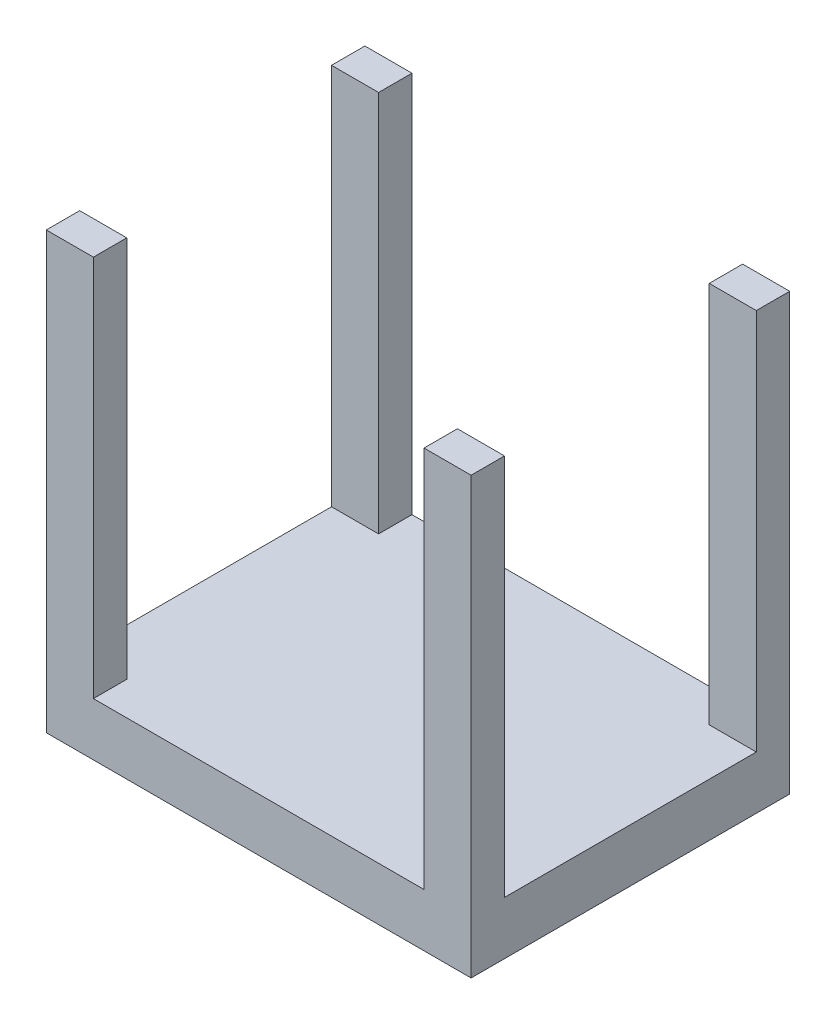
from build123d import *

# Parameters (mm, degrees)
SKETCH1_W           = 2000
SKETCH1_H           = 1500
BOSS_EXTRUDE1_DEPTH = 250
SKETCH2_W           = 221.636306229
SKETCH2_H           = 157.228805466
BOSS_EXTRUDE3_DEPTH = 1800
BOSS_EXTRUDE4_DEPTH = 40


with BuildPart() as part:
    # Sketch1 → Boss-Extrude1 (new body)
    with BuildSketch(Plane(origin=(0, 0, 0), x_dir=(1, 0, 0), z_dir=(0, 1, 0))):
        Rectangle(SKETCH1_W, SKETCH1_H)
    extrude(amount=BOSS_EXTRUDE1_DEPTH)

    # Sketch2 → Boss-Extrude3 (add)
    with BuildSketch(Plane(origin=(0, 250, 0), x_dir=(1, 0, 0), z_dir=(0, 1, 0))):
        with Locations((-889.181846886, 671.385597267)):
            Rectangle(SKETCH2_W, SKETCH2_H)
        with Locations((889.181846886, 671.385597267)):
            Rectangle(SKETCH2_W, SKETCH2_H)
        with Locations((889.181846886, -671.385597267)):
            Rectangle(SKETCH2_W, SKETCH2_H)
        with Locations((-889.181846886, -671.385597267)):
            Rectangle(SKETCH2_W, SKETCH2_H)
    extrude(amount=BOSS_EXTRUDE3_DEPTH)

    # Sketch3 → Boss-Extrude4 (add)
    # profile 1 of 7: a face of its own
    with BuildSketch(Plane.XZ):
        Polygon((349.818069138, -525.845414506), (345.657063703, -510.628023202), (319.553123485, -510.628023202), (315.256248485, -525.845414506), (301.278666964, -525.845414506), (323.527308268, -450.845414506), (343.24537892, -450.845414506), (365.409101746, -525.845414506), align=None)
        Polygon((332.800406094, -463.702072115), (322.949862616, -498.671501462), (342.396194138, -498.671501462), align=None, mode=Mode.SUBTRACT)
    # profile 2 of 7: a face of its own
    with BuildSketch(Plane.XZ):
        with BuildLine():
            add(Edge.make_bspline(
                [(418.126493051, -503.359001462), (418.109429647, -504.220633521), (418.075962282, -505.910598559), (417.738316372, -508.388055539), (417.217642481, -510.753916093), (416.492556496, -512.999132114), (415.550987824, -515.104746917), (414.415222252, -517.059897886), (413.078709748, -518.862444112), (411.543704545, -520.495158805), (409.822683149, -521.966676967), (407.893333374, -523.243978154), (405.783231967, -524.371944078), (403.465577681, -525.302867809), (400.956128367, -526.031751052), (398.255948839, -526.55189375), (395.359615146, -526.883440473), (393.359553263, -526.915724423), (392.328259355, -526.932371028)],
                knots=[0, 0, 0, 0, 1.043797065, 2.047255008, 3.02446924, 3.9770659, 4.901594945, 5.814851324, 6.712376639, 7.615315163, 8.52555054, 9.450461459, 10.414334753, 11.420954898, 12.471899648, 13.57672537, 14.75048448, 16, 16, 16, 16], degree=3))
            add(Edge.make_bspline(
                [(392.328259355, -526.932371028), (391.552131457, -526.926512298), (390.014500231, -526.914905234), (387.738830579, -526.702980167), (385.50078981, -526.452621518), (383.333534333, -526.034972135), (381.248297526, -525.547297979), (379.288771427, -524.987893156), (377.45290972, -524.382755572), (376.298709932, -523.904837834), (375.735188703, -523.671501462)],
                knots=[0, 0, 0, 0, 1.093809551, 2.16700846, 3.2204337, 4.267793217, 5.276510592, 6.239172764, 7.140301759, 8, 8, 8, 8], degree=3))
            Line((375.735188703, -523.671501462), (375.735188703, -509.54106668))
            add(Edge.make_bspline(
                [(375.735188703, -509.54106668), (376.254836906, -509.91937628), (377.342554551, -510.711246674), (379.172788259, -511.730863442), (381.201949231, -512.62361539), (383.348397319, -513.449588035), (385.593376395, -514.101663145), (387.890347021, -514.59757715), (390.207766243, -514.915943826), (391.761158354, -514.955980299), (392.532063703, -514.975849289)],
                knots=[0, 0, 0, 0, 0.859696907, 1.799501065, 2.796540648, 3.825235634, 4.87538795, 5.92159684, 6.968546254, 8, 8, 8, 8], degree=3))
            add(Edge.make_bspline(
                [(392.532063703, -514.975849289), (393.186257548, -514.941128832), (394.541452269, -514.869203698), (396.209323799, -514.420382934), (397.554725273, -513.936360564), (398.499280396, -513.387603607), (399.421075568, -512.781031116), (400.265964515, -512.026923185), (401.051319642, -511.155365607), (401.765228414, -510.162637086), (402.411598759, -509.055829365), (402.980873862, -507.819873596), (403.432641608, -506.441353676), (403.781925821, -504.914072594), (403.953590779, -503.232721942), (403.981565618, -502.062877423), (403.996058268, -501.456827549)],
                knots=[0, 0, 0, 0, 1.374054582, 2.846421637, 3.611300778, 4.373210224, 5.135863178, 5.928667747, 6.746197024, 7.598598875, 8.494837392, 9.43761231, 10.453940893, 11.539761644, 12.72544845, 14, 14, 14, 14], degree=3))
            Line((403.996058268, -501.456827549), (403.996058268, -462.801936245))
            Line((403.996058268, -462.801936245), (376.822145224, -462.801936245))
            Line((376.822145224, -462.801936245), (376.822145224, -450.845414506))
            Line((376.822145224, -450.845414506), (418.126493051, -450.845414506))
            Line((418.126493051, -450.845414506), (418.126493051, -503.359001462))
        make_face()
    # profile 3 of 7: a face of its own
    with BuildSketch(Plane.XZ):
        Polygon((478.078938703, -525.845414506), (473.917933268, -510.628023202), (447.813993051, -510.628023202), (443.517118051, -525.845414506), (429.539536529, -525.845414506), (451.788177833, -450.845414506), (471.506248485, -450.845414506), (493.669971311, -525.845414506), align=None)
        Polygon((461.061275659, -463.702072115), (451.210732181, -498.671501462), (470.657063703, -498.671501462), align=None, mode=Mode.SUBTRACT)
    # profile 4 of 7: a face of its own
    with BuildSketch(Plane.XZ):
        Polygon((533.343884355, -499.282914506), (533.343884355, -525.845414506), (519.213449572, -525.845414506), (519.213449572, -499.38481668), (495.300406094, -450.845414506), (510.517797398, -450.845414506), (521.438313703, -474.028159071), (526.44850392, -485.390251462), (531.52662892, -473.688485158), (543.126493051, -450.845414506), (558.343884355, -450.845414506), align=None)
    # profile 5 of 7: a face of its own
    with BuildSketch(Plane.XZ):
        Polygon((672.474319138, -510.628023202), (672.474319138, -525.845414506), (659.26100392, -525.845414506), (659.26100392, -510.628023202), (624.648232181, -510.628023202), (624.648232181, -499.011175376), (653.639400659, -450.845414506), (672.474319138, -450.845414506), (672.474319138, -498.671501462), (684.430840877, -498.671501462), (684.430840877, -510.628023202), align=None)
        Polygon((659.430840877, -464.398403636), (638.337090877, -498.671501462), (659.430840877, -498.671501462), align=None, mode=Mode.SUBTRACT)
    # profile 6 of 7: a face of its own
    with BuildSketch(Plane.XZ):
        with BuildLine():
            add(Edge.make_bspline(
                [(746.387362616, -502.00030581), (746.358999506, -502.918574003), (746.303260224, -504.72315785), (745.931439689, -507.36768055), (745.283451243, -509.87874182), (744.379315203, -512.244166214), (743.251987777, -514.460400495), (741.928195453, -516.527250334), (740.383296401, -518.416954404), (738.671284668, -520.159772114), (736.756373674, -521.703989379), (734.676468149, -523.079485625), (732.3973799, -524.221477248), (729.974758497, -525.219919838), (727.391280552, -525.965453477), (724.69221643, -526.541449848), (721.864705905, -526.856796198), (719.938795076, -526.906882156), (718.958694138, -526.932371028)],
                knots=[0, 0, 0, 0, 1.059424649, 2.081985008, 3.073706857, 4.045372538, 4.997657502, 5.937972637, 6.871365894, 7.808954813, 8.751535771, 9.704447739, 10.680122655, 11.688059248, 12.723472597, 13.777750311, 14.869091458, 16, 16, 16, 16], degree=3))
            add(Edge.make_bspline(
                [(718.958694138, -526.932371028), (717.899044886, -526.904380591), (715.835235837, -526.849865462), (712.834976432, -526.482398661), (710.029590105, -525.834930969), (707.415062857, -524.932929222), (704.981401167, -523.782816485), (702.765994063, -522.334903801), (700.718739749, -520.667399445), (698.898408533, -518.710886489), (697.26679965, -516.498566132), (695.864125368, -514.008452033), (694.670058117, -511.253472605), (693.712727372, -508.228512103), (692.945730892, -504.935965971), (692.41731115, -501.369044448), (692.088858497, -497.534146571), (692.056331889, -494.89050564), (692.039536529, -493.52544168)],
                knots=[0, 0, 0, 0, 1.03815604, 2.021948138, 2.955683688, 3.853781731, 4.727044037, 5.585525897, 6.440578592, 7.307778037, 8.196371401, 9.127880331, 10.101630024, 11.133022373, 12.232221915, 13.410445646, 14.662864052, 16, 16, 16, 16], degree=3))
            add(Edge.make_bspline(
                [(692.039536529, -493.52544168), (692.076852854, -491.514742021), (692.149735683, -487.587627604), (692.592507732, -482.750849359), (693.184037234, -479.059852531), (693.744163977, -476.423739417), (694.419470576, -473.893532571), (695.220722113, -471.470861573), (696.142349199, -469.149009841), (697.261174692, -466.96652416), (698.480212963, -464.868995111), (699.880248789, -462.903889671), (701.419550219, -461.036834631), (703.164238542, -459.332960452), (705.090681898, -457.786607344), (707.199530324, -456.38350924), (709.494933936, -455.127393203), (711.992651123, -454.026326383), (714.677984232, -453.051015719), (717.583115838, -452.262954149), (720.699823027, -451.609239242), (724.05998148, -451.161230305), (727.65536083, -450.886928476), (730.133446111, -450.859512517), (731.407743051, -450.845414506)],
                knots=[0, 0, 0, 0, 1.976547138, 3.860410843, 4.767994696, 5.649913047, 6.508467878, 7.340868787, 8.157266271, 8.961144072, 9.749500259, 10.540053303, 11.330253693, 12.125182237, 12.932596625, 13.755267206, 14.612016528, 15.501400673, 16.436149801, 17.417702134, 18.457833939, 19.564401112, 20.747550686, 22, 22, 22, 22], degree=3))
            Line((731.407743051, -450.845414506), (739.865623485, -450.845414506))
            Line((739.865623485, -450.845414506), (739.865623485, -462.801936245))
            Line((739.865623485, -462.801936245), (730.116982181, -462.801936245))
            add(Edge.make_bspline(
                [(730.116982181, -462.801936245), (729.14868365, -462.820838744), (727.294341827, -462.857038008), (724.628469755, -463.058091612), (722.213781056, -463.476982192), (720.024494202, -464.002002822), (718.063382258, -464.715820894), (716.290329428, -465.534589741), (714.711013918, -466.516989436), (713.303893319, -467.6178152), (712.094961858, -468.877734807), (711.02549488, -470.240147742), (710.142021832, -471.75302657), (709.412955133, -473.383711328), (708.844321284, -475.137360742), (708.366042838, -476.985131206), (708.010168628, -478.950112438), (707.860258208, -480.299733176), (707.783422398, -480.991474289)],
                knots=[0, 0, 0, 0, 1.423478769, 2.726035548, 3.924357971, 5.022209848, 6.030273504, 6.986885351, 7.887426126, 8.758102054, 9.605443966, 10.447622359, 11.298145025, 12.173421022, 13.068060847, 14.004483491, 14.977208358, 16, 16, 16, 16], degree=3))
            Line((707.783422398, -480.991474289), (707.664536529, -482.367153636))
            add(Edge.make_bspline(
                [(707.664536529, -482.367153636), (708.702342089, -481.90558614), (710.87270685, -480.94030915), (713.795383896, -480.139769537), (716.280192882, -479.590310643), (718.238488057, -479.307141527), (720.240495628, -479.131426553), (721.590794286, -479.114702642), (722.27051479, -479.106284071)],
                knots=[0, 0, 0, 0, 1.353466238, 2.830506543, 3.604166176, 4.389356568, 5.189225763, 6, 6, 6, 6], degree=3))
            add(Edge.make_bspline(
                [(722.27051479, -479.106284071), (723.239281777, -479.126447315), (725.12466924, -479.165688461), (727.857978781, -479.451171105), (730.411732811, -479.939639933), (732.773356041, -480.640076894), (734.964088675, -481.500314284), (736.959342046, -482.553115675), (738.758699671, -483.791973899), (740.386134597, -485.179313345), (741.795548364, -486.765536528), (743.052536351, -488.474368201), (744.069302322, -490.376181604), (744.922341072, -492.416460725), (745.578311098, -494.615083298), (746.057096356, -496.949955837), (746.323409706, -499.429613366), (746.365658318, -501.127865855), (746.387362616, -502.00030581)],
                knots=[0, 0, 0, 0, 1.227030027, 2.388011836, 3.47657088, 4.515826141, 5.503917736, 6.453472508, 7.366470906, 8.266420937, 9.154984559, 10.048655491, 10.94720442, 11.879460569, 12.845897995, 13.848661696, 14.894797149, 16, 16, 16, 16], degree=3))
        make_face()
        with BuildLine():
            add(Edge.make_bspline(
                [(732.256927833, -502.679653636), (732.228523443, -501.861019442), (732.173437561, -500.273406169), (731.629850532, -498.018081324), (730.787867881, -495.974709681), (729.685261743, -494.550142011), (728.653467981, -493.568531696), (727.75326334, -492.947609603), (726.779171268, -492.372999673), (725.689817598, -491.901828744), (724.494054791, -491.528654506), (723.19153868, -491.260168606), (721.782745929, -491.085072654), (720.804809995, -491.070382671), (720.300406094, -491.06280581)],
                knots=[0, 0, 0, 0, 1.54937684, 3.004774602, 4.374742618, 5.707885042, 6.383767977, 7.068794033, 7.775753736, 8.525578529, 9.313172552, 10.146816404, 11.044157186, 12, 12, 12, 12], degree=3))
            add(Edge.make_bspline(
                [(720.300406094, -491.06280581), (719.693867842, -491.074001961), (718.476757635, -491.096468722), (716.674950373, -491.336340538), (714.899645984, -491.654533859), (713.188785931, -492.076557834), (711.549082449, -492.576496262), (710.006231617, -493.10982999), (708.573761138, -493.680263552), (707.684805987, -494.114611812), (707.256927833, -494.323675376)],
                knots=[0, 0, 0, 0, 1.073419983, 2.153978604, 3.213830722, 4.266642452, 5.271991501, 6.248486412, 7.156949146, 8, 8, 8, 8], degree=3))
            add(Edge.make_bspline(
                [(707.256927833, -494.323675376), (707.265290409, -495.235424468), (707.281353185, -496.986705679), (707.441399118, -499.496211873), (707.663698736, -501.789417279), (708.019521969, -503.866164894), (708.480857057, -505.742407237), (709.014808353, -507.443103479), (709.675665006, -508.957516094), (710.443067147, -510.297716611), (711.31259504, -511.464442252), (712.280639509, -512.457613278), (713.358355722, -513.272882693), (714.535015177, -513.924411297), (715.823203121, -514.391244249), (717.194590654, -514.733598455), (718.658126231, -514.938842654), (719.665690797, -514.963318642), (720.181520224, -514.975849289)],
                knots=[0, 0, 0, 0, 1.575147918, 3.025532987, 4.343432588, 5.554366179, 6.662306806, 7.68004023, 8.630540147, 9.51139375, 10.342849251, 11.138311083, 11.899347471, 12.66988, 13.452976388, 14.259606707, 15.108993997, 16, 16, 16, 16], degree=3))
            add(Edge.make_bspline(
                [(720.181520224, -514.975849289), (720.629452147, -514.968377902), (721.506090256, -514.953755808), (722.78884141, -514.770757869), (724.010841884, -514.51289099), (725.523373564, -513.986041203), (727.251206946, -513.090405602), (729.029341036, -511.616342056), (730.427494795, -509.784815326), (731.295642889, -508.03526598), (731.787154542, -506.510560952), (732.053522763, -505.287508688), (732.234385949, -504.004081712), (732.249304809, -503.127537553), (732.256927833, -502.679653636)],
                knots=[0, 0, 0, 0, 0.831365517, 1.627047902, 2.402672276, 3.14760547, 4.596377666, 5.992636189, 7.401941747, 8.845743868, 9.597327724, 10.372952098, 11.168634483, 12, 12, 12, 12], degree=3))
        make_face(mode=Mode.SUBTRACT)
    # profile 7 of 7: a face of its own
    with BuildSketch(Plane.XZ):
        Polygon((800.735188703, -510.628023202), (800.735188703, -525.845414506), (787.521873485, -525.845414506), (787.521873485, -510.628023202), (752.909101746, -510.628023202), (752.909101746, -499.011175376), (781.900270224, -450.845414506), (800.735188703, -450.845414506), (800.735188703, -498.671501462), (812.691710442, -498.671501462), (812.691710442, -510.628023202), align=None)
        Polygon((787.691710442, -464.398403636), (766.597960442, -498.671501462), (787.691710442, -498.671501462), align=None, mode=Mode.SUBTRACT)
    extrude(amount=BOSS_EXTRUDE4_DEPTH)


solid = part.part
